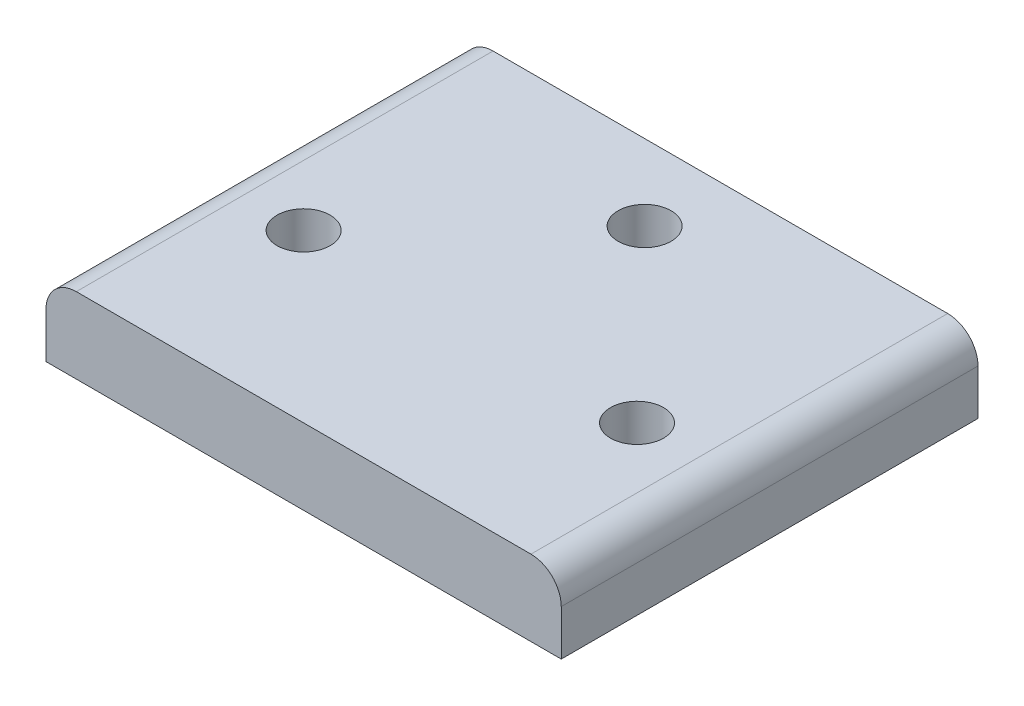
from build123d import *

# Parameters (mm, degrees)
SKETCH1_W           = 34
SKETCH1_H           = 27.5
SKETCH1_R           = 1.75
BOSS_EXTRUDE1_DEPTH = 5
FILLET1_R           = 2
SKETCH2_R           = 5.25
CUT_EXTRUDE1_DEPTH  = 0.4


with BuildPart() as part:
    # Sketch1 → Boss-Extrude1 (new body)
    with BuildSketch(Plane(origin=(0, 0, 0), x_dir=(1, 0, 0), z_dir=(0, 1, 0))):
        Rectangle(SKETCH1_W, SKETCH1_H)
        with Locations(Location((0, 8.75, 0), (0, 0, 270))):
            Circle(SKETCH1_R, mode=Mode.SUBTRACT)
        with Locations(Location((-11, -2.75, 0), (0, 0, 270))):
            Circle(SKETCH1_R, mode=Mode.SUBTRACT)
        with Locations(Location((11, -2.75, 0), (0, 0, 270))):
            Circle(SKETCH1_R, mode=Mode.SUBTRACT)
    extrude(amount=BOSS_EXTRUDE1_DEPTH)

    # Fillet1
    fillet1_edges = [part.edges().sort_by_distance(p)[0] for p in [
        (-17, 5, 0),
        (17, 5, 0),
    ]]
    fillet(fillet1_edges, radius=FILLET1_R)

    # Sketch2 → Cut-Extrude1 (cut)
    with BuildSketch(Plane.XZ):
        with Locations(Location((-5.3, 7.5, 0), (0, 0, 270))):
            Circle(SKETCH2_R)
        with Locations(Location((5.3, 7.5, 0), (0, 0, 270))):
            Circle(SKETCH2_R)
        with Locations(Location((0, -1.7, 0), (0, 0, 270))):
            Circle(SKETCH2_R)
    extrude(amount=-CUT_EXTRUDE1_DEPTH, mode=Mode.SUBTRACT)


solid = part.part
